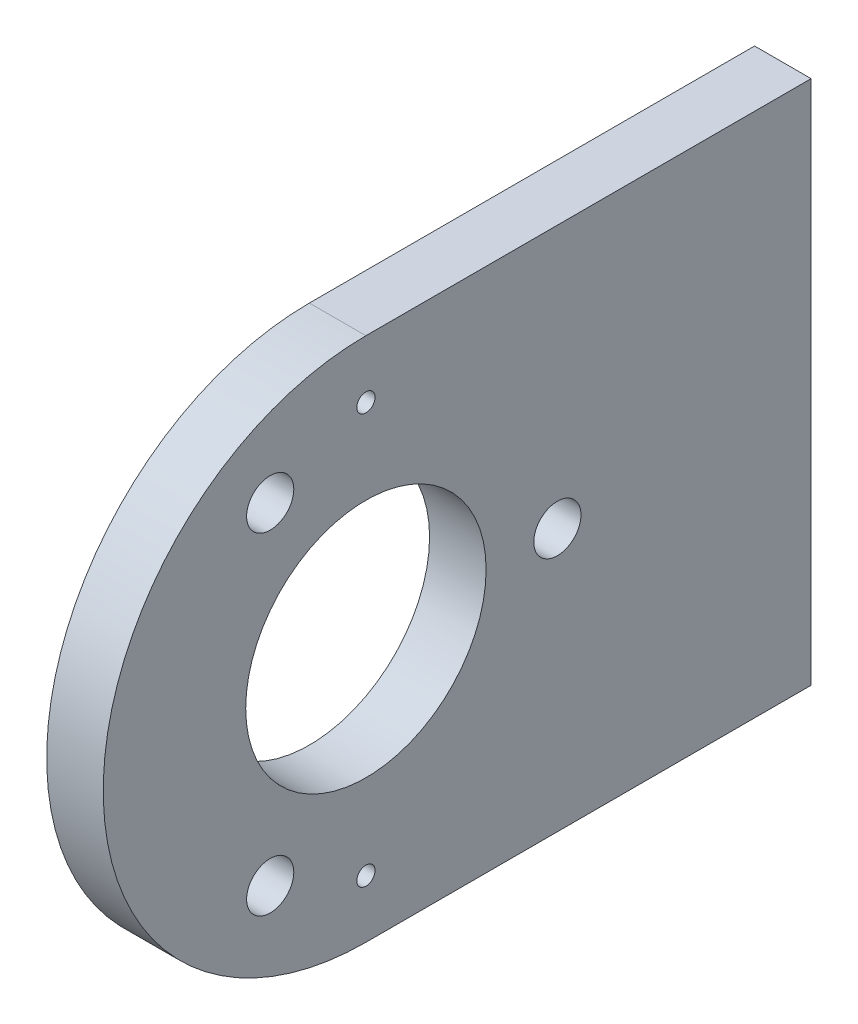
from build123d import *

# Parameters (mm, degrees)
SKETCH1_R                    = 2.65
SKETCH1_R_2                  = 13.5
BOSS_EXTRUDE1_DEPTH          = 6.35
M2_5X0_45_TAPPED_HOLE1_D     = 2.05
M2_5X0_45_TAPPED_HOLE2_D     = 2.05
M2_5X0_45_TAPPED_HOLE2_DEPTH = 6.35
M2_5X0_45_TAPPED_HOLE2_TIP   = 0.615882135


with BuildPart() as part:
    # Sketch1 → Boss-Extrude1 (new body)
    with BuildSketch(Plane(origin=(0, 0, 0), x_dir=(0, 0, -1), z_dir=(1, 0, 0))):
        with BuildLine():
            Line((-50, 29.5), (0, 29.5))
            Line((0, 29.5), (0, -29.5))
            Line((0, -29.5), (-50, -29.5))
            ThreePointArc((-50, -29.5), (-79.5, 0), (-50, 29.5))
        make_face()
        with Locations((-60.75, -18.619546181)):
            Circle(SKETCH1_R, mode=Mode.SUBTRACT)
        with Locations((-28.5, 0)):
            Circle(SKETCH1_R, mode=Mode.SUBTRACT)
        with Locations((-60.75, 18.619546181)):
            Circle(SKETCH1_R, mode=Mode.SUBTRACT)
        with Locations((-50, 0)):
            Circle(SKETCH1_R_2, mode=Mode.SUBTRACT)
    extrude(amount=BOSS_EXTRUDE1_DEPTH)

    # M2.5x0.45 Tapped Hole1 (through all)
    with Locations(Plane(origin=(6.35, 0, 0), x_dir=(0, 0, -1), z_dir=(1, 0, 0))):
        with Locations((-50, -23.015), (-50, 23.015)):
            Hole(M2_5X0_45_TAPPED_HOLE1_D / 2)

    # M2.5x0.45 Tapped Hole2
    with Locations(Plane(origin=(0, 0, 0), x_dir=(-1, 0, 0), z_dir=(0, 0, -1))):
        with Locations((-3.175, 0), (-3.175, 12.75), (-3.175, 25.5), (-3.175, -12.75), (-3.175, -25.5)):
            Hole(M2_5X0_45_TAPPED_HOLE2_D / 2, depth=M2_5X0_45_TAPPED_HOLE2_DEPTH)
            with Locations((0, 0, -(M2_5X0_45_TAPPED_HOLE2_DEPTH + M2_5X0_45_TAPPED_HOLE2_TIP / 2))):  # 118° drill point
                Cone(0, M2_5X0_45_TAPPED_HOLE2_D / 2, M2_5X0_45_TAPPED_HOLE2_TIP, mode=Mode.SUBTRACT)


solid = part.part
